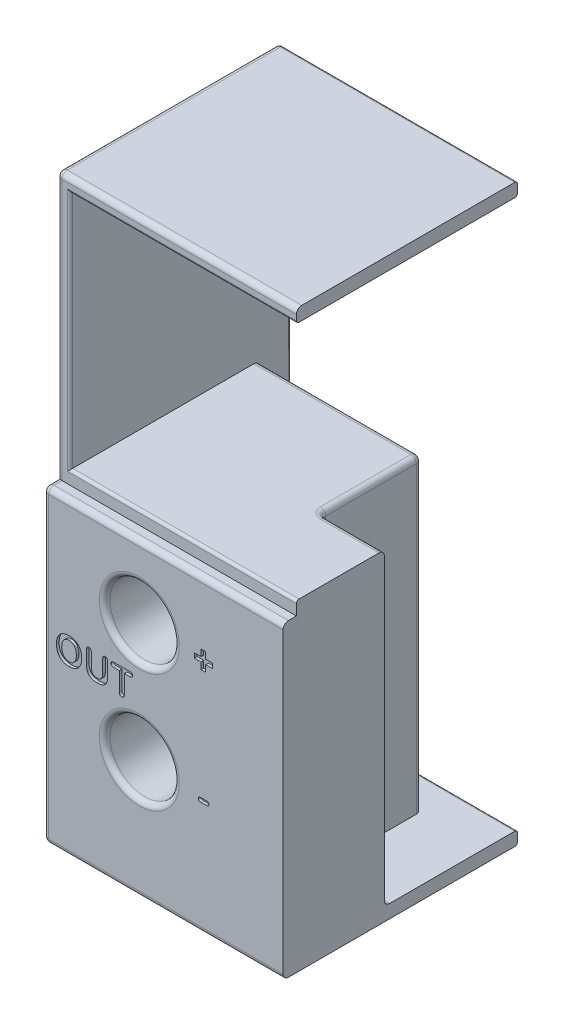
from build123d import *

# Parameters (mm, degrees)
SKETCH2_W               = 87.999717
SKETCH2_H               = 108
SKETCH2_R               = 6.5
SKETCH2_W_2             = 63.5
SKETCH2_H_2             = 21.25
BOSS_EXTRUDE1_DEPTH     = 46
SKETCH4_W               = 63.5
SKETCH4_H               = 21.25
BOSS_EXTRUDE2_DEPTH     = 44
BOSS_EXTRUDE3_START     = -10
SKETCH5_R               = 6.5
BOSS_EXTRUDE3_DEPTH     = 10
BOSS_EXTRUDE4_DEPTH     = 46
CUT_EXTRUDE1_START      = -45
SKETCH3_W               = 2
SKETCH3_H               = 20
CUT_EXTRUDE1_DEPTH      = 28
CUT_EXTRUDE2_START      = 45
SKETCH3_3_W             = 2
SKETCH3_3_H             = 20
CUT_EXTRUDE2_DEPTH      = 28
SKETCH6_W               = 85
SKETCH6_H               = 45
SKETCH6_W_2             = 63.5
SKETCH6_H_2             = 21.25
CUT_EXTRUDE4_DEPTH      = 85.00595217
SKETCH8_R               = 4.25
CUT_EXTRUDE5_DEPTH      = 79.974679487
SKETCH9_W               = 85
SKETCH9_H               = 103
CUT_EXTRUDE6_DEPTH      = 8
SKETCH6_4_W             = 90
SKETCH6_4_H             = 50
SKETCH6_4_W_2           = 85
SKETCH6_4_H_2           = 45
CUT_EXTRUDE7_DEPTH      = 2.5
CUT_EXTRUDE8_DEPTH      = 85.00595217
CUT_EXTRUDE8_DEPTH_BACK = 85.00595217
SKETCH10_W              = 2
SKETCH10_H              = 108
FILLET2_R               = 1
FILLET3_R               = 0.5
SKETCH11_W              = 24
SKETCH11_H              = 58
CUT_EXTRUDE9_DEPTH      = 19
FILLET4_R               = 1
CUT_EXTRUDE10_DEPTH     = 0.5
SKETCH13_W              = 45
SKETCH13_H              = 108
CUT_EXTRUDE12_DEPTH     = 83.927679336


with BuildPart() as part:
    # Sketch2 → Boss-Extrude1 (new body)
    with BuildSketch(Plane.XY):
        Rectangle(SKETCH2_W, SKETCH2_H)
        with Locations((-27, -9.375)):
            Circle(SKETCH2_R, mode=Mode.SUBTRACT)
        with Locations((27, -9.375)):
            Circle(SKETCH2_R, mode=Mode.SUBTRACT)
        with Locations((27, -31.625)):
            Circle(SKETCH2_R, mode=Mode.SUBTRACT)
        with Locations((-27, -31.625)):
            Circle(SKETCH2_R, mode=Mode.SUBTRACT)
        with Locations((0, 32.5)):
            Rectangle(SKETCH2_W_2, SKETCH2_H_2, mode=Mode.SUBTRACT)
    extrude(amount=-BOSS_EXTRUDE1_DEPTH)

    # Sketch4 → Boss-Extrude2 (add)
    with BuildSketch(Plane(origin=(0, 0, -46), x_dir=(-1, 0, 0), z_dir=(0, 0, -1))):
        with Locations((0, 32.5)):
            Rectangle(SKETCH4_W, SKETCH4_H)
    extrude(amount=-BOSS_EXTRUDE2_DEPTH)

    # Sketch5 → Boss-Extrude3 (add)
    with BuildSketch(Plane(origin=(0, 0, -46), x_dir=(-1, 0, 0), z_dir=(0, 0, -1)).offset(BOSS_EXTRUDE3_START)):
        with Locations(Location((-27, -9.375, 0), (0, 0, 180))):
            Circle(SKETCH5_R)
        with Locations(Location((-27, -31.625, 0), (0, 0, 180))):
            Circle(SKETCH5_R)
        with Locations(Location((27, -31.625, 0), (0, 0, 180))):
            Circle(SKETCH5_R)
        with Locations(Location((27, -9.375, 0), (0, 0, 180))):
            Circle(SKETCH5_R)
    extrude(amount=BOSS_EXTRUDE3_DEPTH)

    # Sketch7 → Boss-Extrude4 (add)
    with BuildSketch(Plane.XY):
        Polygon((45, 54), (43.9998585, 52.7998302), (43.9998585, -54), (45, -54), align=None)
        Polygon((-45, 54), (-45, -54), (-43.9998585, -52.7998302), (-43.9998585, 54), align=None)
        Polygon((43.9998585, 54), (43.9998585, 52.7998302), (45, 54), align=None)
        Polygon((-43.9998585, -52.7998302), (-45, -54), (-43.9998585, -54), align=None)
    extrude(amount=-BOSS_EXTRUDE4_DEPTH)

    # Sketch3 → Cut-Extrude1 (cut)
    with BuildSketch(Plane(origin=(0, 0, 0), x_dir=(0, 0, -1), z_dir=(1, 0, 0)).offset(CUT_EXTRUDE1_START)):
        with BuildLine():
            Line((34, -1.125), (34, 0.625))
            Line((34, 0.625), (19, 0.625))
            Line((19, 0.625), (19, -19.375))
            Line((19, -19.375), (34, -19.375))
            Line((34, -19.375), (34, -17.625))
            ThreePointArc((34, -17.625), (27.5, -9.375), (34, -1.125))
        make_face()
        with Locations((35, -9.375)):
            Rectangle(SKETCH3_W, SKETCH3_H)
        with BuildLine():
            Line((34, -21.625), (19, -21.625))
            Line((19, -21.625), (19, -41.625))
            Line((19, -41.625), (34, -41.625))
            Line((34, -41.625), (34, -39.875))
            ThreePointArc((34, -39.875), (27.5, -31.625), (34, -23.375))
            Line((34, -23.375), (34, -21.625))
        make_face()
        with BuildLine():
            Line((34, -39.875), (34, -23.375))
            ThreePointArc((34, -23.375), (27.5, -31.625), (34, -39.875))
        make_face()
        with Locations((35, -31.625)):
            Rectangle(SKETCH3_W, SKETCH3_H)
        with BuildLine():
            Line((34, -17.625), (34, -1.125))
            ThreePointArc((34, -1.125), (27.5, -9.375), (34, -17.625))
        make_face()
    extrude(amount=CUT_EXTRUDE1_DEPTH, mode=Mode.SUBTRACT)

    # Sketch3<3> → Cut-Extrude2 (cut)
    with BuildSketch(Plane(origin=(0, 0, 0), x_dir=(0, 0, -1), z_dir=(1, 0, 0)).offset(CUT_EXTRUDE2_START)):
        with BuildLine():
            Line((34, -1.125), (34, 0.625))
            Line((34, 0.625), (19, 0.625))
            Line((19, 0.625), (19, -19.375))
            Line((19, -19.375), (34, -19.375))
            Line((34, -19.375), (34, -17.625))
            ThreePointArc((34, -17.625), (27.5, -9.375), (34, -1.125))
        make_face()
        with BuildLine():
            Line((34, -17.625), (34, -1.125))
            ThreePointArc((34, -1.125), (27.5, -9.375), (34, -17.625))
        make_face()
        with Locations((35, -9.375)):
            Rectangle(SKETCH3_3_W, SKETCH3_3_H)
        with Locations((35, -31.625)):
            Rectangle(SKETCH3_3_W, SKETCH3_3_H)
        with BuildLine():
            Line((34, -39.875), (34, -23.375))
            ThreePointArc((34, -23.375), (27.5, -31.625), (34, -39.875))
        make_face()
        with BuildLine():
            Line((34, -21.625), (19, -21.625))
            Line((19, -21.625), (19, -41.625))
            Line((19, -41.625), (34, -41.625))
            Line((34, -41.625), (34, -39.875))
            ThreePointArc((34, -39.875), (27.5, -31.625), (34, -23.375))
            Line((34, -23.375), (34, -21.625))
        make_face()
    extrude(amount=-CUT_EXTRUDE2_DEPTH, mode=Mode.SUBTRACT)

    # Sketch6 → Cut-Extrude4 (cut, through all)
    # profile 1 of 2: a face of its own
    with BuildSketch(Plane.XY):
        with Locations((0, 29)):
            Rectangle(SKETCH6_W, SKETCH6_H)
        with Locations((0, 32.5)):
            Rectangle(SKETCH6_W_2, SKETCH6_H_2, mode=Mode.SUBTRACT)
    # profile 2 of 2: a face of its own
    with BuildSketch(Plane.XY):
        with Locations((0, 32.5)):
            Rectangle(SKETCH6_W_2, SKETCH6_H_2)
    extrude(amount=-CUT_EXTRUDE4_DEPTH, mode=Mode.SUBTRACT)

    # Sketch8 → Cut-Extrude5 (cut, through all)
    with BuildSketch(Plane.XY.offset(-36)):
        with Locations((-27, -9.375)):
            Circle(SKETCH8_R)
        with Locations((-27, -31.625)):
            Circle(SKETCH8_R)
        with Locations((27, -31.625)):
            Circle(SKETCH8_R)
        with Locations((27, -9.375)):
            Circle(SKETCH8_R)
    extrude(amount=-CUT_EXTRUDE5_DEPTH, mode=Mode.SUBTRACT)

    # Sketch9 → Cut-Extrude6 (cut)
    with BuildSketch(Plane(origin=(0, 0, -46), x_dir=(-1, 0, 0), z_dir=(0, 0, -1))):
        Rectangle(SKETCH9_W, SKETCH9_H)
    extrude(amount=-CUT_EXTRUDE6_DEPTH, mode=Mode.SUBTRACT)

    # Sketch6<4> → Cut-Extrude7 (cut)
    with BuildSketch(Plane.XY):
        with Locations((0, 29)):
            Rectangle(SKETCH6_4_W, SKETCH6_4_H)
        with Locations((0, 29)):
            Rectangle(SKETCH6_4_W_2, SKETCH6_4_H_2, mode=Mode.SUBTRACT)
    extrude(amount=-CUT_EXTRUDE7_DEPTH, mode=Mode.SUBTRACT)

    # Sketch10 → Cut-Extrude8 (cut, two sides: drawn at the far end of the back side and taken through both)
    with BuildSketch(Plane(origin=(0, 0, 0), x_dir=(0, 0, -1), z_dir=(1, 0, 0)).offset(-CUT_EXTRUDE8_DEPTH_BACK)):
        with Locations((45, 0)):
            Rectangle(SKETCH10_W, SKETCH10_H)
    extrude(amount=CUT_EXTRUDE8_DEPTH + CUT_EXTRUDE8_DEPTH_BACK, mode=Mode.SUBTRACT)

    # Fillet2
    fillet2_edges = [part.edges().sort_by_distance(p)[0] for p in [
        (-17, -31.625, -19),
        (-31, -21.625, -19),
        (-33.5, -31.625, -19),
        (-17, -31.625, -36),
        (-31, -41.625, -36),
        (-17, -41.625, -27.5),
        (-31, -41.625, -19),
        (-45, -21.625, -27.5),
        (-31, -21.625, -36),
        (-17, -21.625, -27.5),
        (-45, -31.625, -19),
        (-45, -31.625, -36),
        (-45, -41.625, -27.5),
        (-45, -9.375, -19),
        (-31, 0.625, -19),
        (-45, -9.375, -36),
        (-31, -19.375, -36),
        (-33.5, -9.375, -19),
        (-17, -19.375, -27.5),
        (-31, -19.375, -19),
        (-45, 0.625, -27.5),
        (-31, 0.625, -36),
        (-17, -9.375, -19),
        (-17, -9.375, -36),
        (-17, 0.625, -27.5),
        (-45, -19.375, -27.5),
        (45, -9.375, -36),
        (31, 0.625, -36),
        (45, -9.375, -19),
        (31, -19.375, -19),
        (17, -19.375, -27.5),
        (31, -19.375, -36),
        (20.5, -9.375, -19),
        (45, 0.625, -27.5),
        (31, 0.625, -19),
        (17, -9.375, -36),
        (17, -9.375, -19),
        (17, 0.625, -27.5),
        (45, -19.375, -27.5),
        (17, -31.625, -19),
        (31, -41.625, -19),
        (20.5, -31.625, -19),
        (17, -31.625, -36),
        (31, -21.625, -36),
        (45, -41.625, -27.5),
        (31, -41.625, -36),
        (17, -21.625, -27.5),
        (31, -21.625, -19),
        (17, -41.625, -27.5),
        (45, -31.625, -36),
        (45, -21.625, -27.5),
        (45, -31.625, -19),
        (0, -54, 0),
        (22.75, -9.375, -36),
        (20.5, -31.625, 0),
        (22.75, -31.625, -36),
        (-31.25, -31.625, -36),
        (-31.25, -9.375, -36),
        (20.5, -9.375, 0),
        (-33.5, -31.625, 0),
        (-33.5, -9.375, 0),
        (0, 6.5, -38),
        (-45, -25, 0),
        (45, -25, 0),
        (-45, 29, -2.5),
        (-45, 4, -1.25),
        (0, 54, -2.5),
        (45, 29, -2.5),
        (45, 4, -1.25),
        (0, 4, 0),
        (-45, -54, -22),
        (45, -54, -22),
        (-45, 54, -23.25),
        (45, 54, -23.25),
    ]]
    fillet(fillet2_edges, radius=FILLET2_R)

    # Fillet3
    fillet3_edges = [part.edges().sort_by_distance(p)[0] for p in [
        (22.75, -31.625, -38),
        (22.75, -9.375, -38),
        (-31.25, -9.375, -38),
        (-31.25, -31.625, -38),
        (0, 51.5, -2.5),
        (-42.5, 29, -2.5),
        (0, 6.5, -2.5),
        (42.5, 29, -2.5),
        (0, -51.5, -44),
        (42.5, 0, -44),
        (0, 51.5, -44),
        (-42.5, 0, -44),
        (-45, 0, -44),
        (45, 0, -44),
        (0, -54, -44),
        (0, 54, -44),
        (44.707106781, 53.707106781, -44),
        (-44.707106781, 53.707106781, -44),
        (-44.707106781, -53.707106781, -44),
        (44.707106781, -53.707106781, -44),
    ]]
    fillet(fillet3_edges, radius=FILLET3_R)

    # Sketch11 → Cut-Extrude9 (cut)
    with BuildSketch(Plane(origin=(0, 0, -38), x_dir=(-1, 0, 0), z_dir=(0, 0, -1))):
        with Locations((0, -22.5)):
            Rectangle(SKETCH11_W, SKETCH11_H)
    extrude(amount=-CUT_EXTRUDE9_DEPTH, mode=Mode.SUBTRACT)

    # Fillet4
    fillet4_edges = [part.edges().sort_by_distance(p)[0] for p in [
        (12, 6.207106781, -37.707106781),
        (-12, 6.207106781, -37.707106781),
        (-12, -23, -38),
        (12, -23, -38),
        (-12, 6.5, -28),
        (12, 6.5, -28),
        (-12, -22.5, -19),
        (0, -51.5, -19),
        (12, -22.5, -19),
        (0, 6.5, -19),
    ]]
    fillet(fillet4_edges, radius=FILLET4_R)

    # Sketch12 → Cut-Extrude10 (cut)
    # profile 1 of 9: a face of its own
    with BuildSketch(Plane.XY):
        with BuildLine():
            add(Edge.make_bspline(
                [(-40.204101563, -18.0625), (-40.142219014, -18.063368709), (-40.020879099, -18.065072082), (-39.842278019, -18.0805127), (-39.670025809, -18.103431299), (-39.504239086, -18.136420072), (-39.345329126, -18.179465633), (-39.193265668, -18.232369375), (-39.047852761, -18.294956068), (-38.908920342, -18.365997783), (-38.77799459, -18.446416769), (-38.654241911, -18.534359089), (-38.539064026, -18.631114909), (-38.43219245, -18.735834907), (-38.334309043, -18.848804815), (-38.243990785, -18.969397378), (-38.161933411, -19.098290949), (-38.089020705, -19.23545814), (-38.023513565, -19.378849399), (-37.966648985, -19.528884986), (-37.919187553, -19.684929266), (-37.879709879, -19.847240726), (-37.849789796, -20.015581804), (-37.828714559, -20.190346757), (-37.81412411, -20.370846257), (-37.813046628, -20.493459783), (-37.8125, -20.555664063)],
                knots=[0, 0, 0, 0, 1.137132438, 2.22970057, 3.292424762, 4.329649132, 5.333981859, 6.315987487, 7.286185149, 8.241436353, 9.181332131, 10.107725602, 11.0292572, 11.943085262, 12.854854597, 13.773819033, 14.709898734, 15.660115542, 16.626635295, 17.605574315, 18.606712189, 19.622473761, 20.67399022, 21.747038223, 22.857027702, 24, 24, 24, 24], degree=3))
            add(Edge.make_bspline(
                [(-37.8125, -20.555664063), (-37.814407642, -20.646879139), (-37.818150658, -20.825853777), (-37.846542647, -21.087869401), (-37.894672643, -21.337285549), (-37.96022212, -21.574001048), (-38.046378281, -21.796377097), (-38.151196568, -22.00412166), (-38.275708195, -22.196231979), (-38.418571732, -22.372534386), (-38.57924091, -22.5320302), (-38.758813404, -22.671073825), (-38.956175636, -22.789747841), (-39.169574475, -22.889709328), (-39.400288076, -22.968467406), (-39.647849295, -23.021416856), (-39.910729065, -23.057454879), (-40.09166815, -23.060788415), (-40.184570313, -23.0625)],
                knots=[0, 0, 0, 0, 1.119700056, 2.196982321, 3.230778928, 4.235358115, 5.208318876, 6.153781848, 7.087131445, 8.013361148, 8.934611457, 9.860297843, 10.794468433, 11.756326826, 12.748403726, 13.780058436, 14.860183413, 16, 16, 16, 16], degree=3))
            add(Edge.make_bspline(
                [(-40.184570313, -23.0625), (-40.276803124, -23.06027942), (-40.457365589, -23.055932231), (-40.720582827, -23.021097135), (-40.969461773, -22.965059913), (-41.20258146, -22.884937151), (-41.418313513, -22.78290435), (-41.617562497, -22.664138614), (-41.796462748, -22.523837845), (-41.957312206, -22.366006832), (-42.100098053, -22.190396648), (-42.221488428, -21.996136894), (-42.328544833, -21.787455566), (-42.413165738, -21.561257329), (-42.480490707, -21.32244949), (-42.5279401, -21.072812122), (-42.556870777, -20.813835192), (-42.56060378, -20.638096536), (-42.5625, -20.548828125)],
                knots=[0, 0, 0, 0, 1.130091603, 2.212359386, 3.247930852, 4.252250901, 5.226719473, 6.16821431, 7.089197795, 8.00610207, 8.925165125, 9.855999165, 10.808795857, 11.79501972, 12.810514548, 13.846493258, 14.906102224, 16, 16, 16, 16], degree=3))
            add(Edge.make_bspline(
                [(-42.5625, -20.548828125), (-42.560779931, -20.457917793), (-42.557397661, -20.279155552), (-42.52617064, -20.017250939), (-42.476867474, -19.76650569), (-42.406593898, -19.528182138), (-42.317493046, -19.303954514), (-42.20934334, -19.096268157), (-42.084128705, -18.905766816), (-41.941020547, -18.732813051), (-41.779791607, -18.578459843), (-41.601343885, -18.443470626), (-41.406555768, -18.327351299), (-41.195418304, -18.231841316), (-40.968892091, -18.155181952), (-40.727036042, -18.101058131), (-40.470304863, -18.068269124), (-40.294370818, -18.064456304), (-40.204101563, -18.0625)],
                knots=[0, 0, 0, 0, 1.125218611, 2.212582392, 3.260701818, 4.286054269, 5.284468473, 6.243521648, 7.180287843, 8.101949555, 9.017004541, 9.937572836, 10.866572707, 11.818894766, 12.801573564, 13.82236102, 14.882684417, 16, 16, 16, 16], degree=3))
        make_face()
        with BuildLine():
            add(Edge.make_bspline(
                [(-38.8125, -20.548828125), (-38.814409711, -20.461806319), (-38.818107355, -20.293311934), (-38.850878723, -20.049572404), (-38.903958219, -19.823491976), (-38.967222357, -19.648437478), (-39.027971578, -19.51867883), (-39.077585349, -19.428366426), (-39.130955162, -19.343341598), (-39.191528722, -19.266437061), (-39.254362066, -19.193984208), (-39.322390378, -19.127691549), (-39.395732164, -19.068546163), (-39.498508546, -18.996758293), (-39.636913927, -18.922373447), (-39.815617192, -18.858633433), (-40.006108222, -18.819354309), (-40.137179526, -18.814816767), (-40.204101563, -18.8125)],
                knots=[0, 0, 0, 0, 1.663767962, 3.22144036, 4.693807908, 6.09809827, 6.772124886, 7.43249818, 8.068074837, 8.689496673, 9.30272399, 9.901527182, 10.503429657, 11.102750509, 12.297797107, 13.495176895, 14.721094103, 16, 16, 16, 16], degree=3))
            add(Edge.make_bspline(
                [(-40.204101563, -18.8125), (-40.252038776, -18.813692449), (-40.346782105, -18.816049209), (-40.485861893, -18.838431131), (-40.619461179, -18.87343406), (-40.746958383, -18.922391316), (-40.86721804, -18.984912243), (-40.979702156, -19.060816842), (-41.083054339, -19.149809619), (-41.177853092, -19.25153021), (-41.263531901, -19.367003595), (-41.339544956, -19.497427585), (-41.40577496, -19.642803935), (-41.462238579, -19.801835484), (-41.506895778, -19.973704465), (-41.538649307, -20.156608918), (-41.558596828, -20.349495293), (-41.561179593, -20.481395653), (-41.5625, -20.548828125)],
                knots=[0, 0, 0, 0, 0.926902171, 1.831933723, 2.71800685, 3.595261319, 4.468550136, 5.334998465, 6.214894287, 7.1017058, 8.020008637, 8.99111482, 10.01694856, 11.106630737, 12.25237115, 13.448355624, 14.695502513, 16, 16, 16, 16], degree=3))
            add(Edge.make_bspline(
                [(-41.5625, -20.548828125), (-41.561175948, -20.616910417), (-41.558585554, -20.750107531), (-41.538678745, -20.94495126), (-41.506717933, -21.130076126), (-41.462379635, -21.304715937), (-41.405018449, -21.466834698), (-41.336159513, -21.614946915), (-41.258965571, -21.750109054), (-41.167899319, -21.868552345), (-41.069532555, -21.973072777), (-40.963817326, -22.06410939), (-40.851516456, -22.141662991), (-40.731554552, -22.204799085), (-40.604589267, -22.252170855), (-40.472024127, -22.288072541), (-40.332998529, -22.308578568), (-40.238345748, -22.311182043), (-40.190429688, -22.3125)],
                knots=[0, 0, 0, 0, 1.300369924, 2.54406124, 3.737115199, 4.88637188, 5.981883645, 7.016846829, 8.003376514, 8.948590554, 9.863559023, 10.741055788, 11.608647785, 12.46534091, 13.323432129, 14.192248925, 15.0848625, 16, 16, 16, 16], degree=3))
            add(Edge.make_bspline(
                [(-40.190429688, -22.3125), (-40.128714879, -22.310432989), (-40.007115757, -22.306360277), (-39.829062488, -22.268333598), (-39.65894479, -22.208545464), (-39.524248456, -22.139704674), (-39.422731166, -22.071892244), (-39.349371171, -22.014681888), (-39.281172171, -21.949579237), (-39.216166088, -21.879097392), (-39.155929432, -21.801699497), (-39.098897641, -21.718367101), (-39.046241602, -21.628209325), (-38.997525615, -21.53173024), (-38.95353172, -21.42910536), (-38.915158866, -21.320607226), (-38.884568811, -21.205758865), (-38.857870644, -21.085626874), (-38.837560064, -20.959421065), (-38.823117244, -20.827745953), (-38.814067885, -20.690231108), (-38.81303074, -20.596694032), (-38.8125, -20.548828125)],
                knots=[0, 0, 0, 0, 1.468568495, 2.893578421, 4.316075305, 5.755382189, 6.482330971, 7.222315454, 7.968369796, 8.725783183, 9.504530818, 10.302500265, 11.129737207, 11.9897977, 12.875655565, 13.787998707, 14.728608307, 15.705132475, 16.718642732, 17.771954593, 18.859838044, 20, 20, 20, 20], degree=3))
        make_face(mode=Mode.SUBTRACT)
    # profile 2 of 9: a face of its own
    with BuildSketch(Plane.XY):
        with BuildLine():
            Line((-36.9375, -20.981445313), (-36.9375, -18.65625))
            add(Edge.make_bspline(
                [(-36.9375, -18.65625), (-36.936347915, -18.609560537), (-36.934186191, -18.521954458), (-36.909347602, -18.399701183), (-36.870478375, -18.295100271), (-36.81330714, -18.209823291), (-36.743514772, -18.143210616), (-36.661901868, -18.096558932), (-36.571075194, -18.066512432), (-36.506755039, -18.06386389), (-36.473632813, -18.0625)],
                knots=[0, 0, 0, 0, 1.314006093, 2.465543923, 3.499702682, 4.438645347, 5.334276599, 6.193453487, 7.069703068, 8, 8, 8, 8], degree=3))
            add(Edge.make_bspline(
                [(-36.473632813, -18.0625), (-36.438939423, -18.064363054), (-36.372286212, -18.067942368), (-36.277450995, -18.095840638), (-36.194605213, -18.143871779), (-36.123835804, -18.210848219), (-36.067342536, -18.296948281), (-36.027775176, -18.402193177), (-36.003534117, -18.525270354), (-36.001222859, -18.613483661), (-36, -18.66015625)],
                knots=[0, 0, 0, 0, 0.96282878, 1.849794185, 2.716851436, 3.599658085, 4.532680285, 5.552030856, 6.704809248, 8, 8, 8, 8], degree=3))
            Line((-36, -18.66015625), (-36, -21.053710938))
            add(Edge.make_bspline(
                [(-36, -21.053710938), (-35.99889066, -21.119176272), (-35.996767426, -21.244474345), (-35.980352355, -21.424389171), (-35.952620356, -21.587521133), (-35.913468807, -21.734879035), (-35.858654871, -21.866513437), (-35.785781742, -21.982442862), (-35.694423845, -22.082436057), (-35.604389303, -22.152348162), (-35.523320188, -22.198607116), (-35.455881093, -22.22899436), (-35.38297238, -22.255675736), (-35.303537405, -22.275251537), (-35.21924944, -22.292442399), (-35.128794967, -22.303466192), (-35.032714084, -22.312002141), (-34.966492651, -22.312331511), (-34.932617188, -22.3125)],
                knots=[0, 0, 0, 0, 1.640841622, 3.140506311, 4.523579023, 5.784571649, 6.954579444, 8.084197464, 9.198982671, 10.333306227, 10.925380769, 11.535182691, 12.185613052, 12.868404783, 13.583722754, 14.340779317, 15.151228418, 16, 16, 16, 16], degree=3))
            add(Edge.make_bspline(
                [(-34.932617188, -22.3125), (-34.886018292, -22.311674313), (-34.796154634, -22.310082015), (-34.666915353, -22.294831437), (-34.547810982, -22.27254376), (-34.439976213, -22.237904472), (-34.342004443, -22.195029342), (-34.254772573, -22.142425249), (-34.177901824, -22.079862251), (-34.111987738, -22.006889167), (-34.056360614, -21.923270422), (-34.007144985, -21.831202928), (-33.966579922, -21.728768874), (-33.932253732, -21.61717405), (-33.906095076, -21.495290392), (-33.887966427, -21.363741724), (-33.877290695, -21.222181646), (-33.875781426, -21.124693418), (-33.875, -21.07421875)],
                knots=[0, 0, 0, 0, 1.187087794, 2.289239917, 3.312641325, 4.270309596, 5.169103343, 6.032749862, 6.858132282, 7.686303516, 8.528484611, 9.411791075, 10.342302716, 11.33164497, 12.384483705, 13.515514569, 14.713654137, 16, 16, 16, 16], degree=3))
            Line((-33.875, -21.07421875), (-33.875, -18.66015625))
            add(Edge.make_bspline(
                [(-33.875, -18.66015625), (-33.873685282, -18.612853927), (-33.871218239, -18.524091977), (-33.848475161, -18.400133957), (-33.808724112, -18.295398446), (-33.752835216, -18.209945927), (-33.683718699, -18.142612396), (-33.601499713, -18.096857609), (-33.509937038, -18.066252371), (-33.444926434, -18.063783409), (-33.411132813, -18.0625)],
                knots=[0, 0, 0, 0, 1.324209478, 2.484855026, 3.512713035, 4.440887327, 5.324452051, 6.186293477, 7.057204391, 8, 8, 8, 8], degree=3))
            add(Edge.make_bspline(
                [(-33.411132813, -18.0625), (-33.377364158, -18.063865071), (-33.311778592, -18.066516314), (-33.21904633, -18.096543029), (-33.135875484, -18.142868959), (-33.064442019, -18.209061932), (-33.00544498, -18.293736648), (-32.965148551, -18.399135464), (-32.941017171, -18.522664676), (-32.938719595, -18.611204538), (-32.9375, -18.658203125)],
                knots=[0, 0, 0, 0, 0.937671153, 1.821147261, 2.686184232, 3.571984669, 4.510357278, 5.535961965, 6.692043289, 8, 8, 8, 8], degree=3))
            Line((-32.9375, -18.658203125), (-32.9375, -20.9921875))
            add(Edge.make_bspline(
                [(-32.9375, -20.9921875), (-32.938814946, -21.083039659), (-32.941339732, -21.257482084), (-32.960267279, -21.507426996), (-32.993362685, -21.733860143), (-33.038094829, -21.939597905), (-33.102992598, -22.128276032), (-33.192235417, -22.30285969), (-33.3043956, -22.466365378), (-33.396080085, -22.562684701), (-33.442382813, -22.611328125)],
                knots=[0, 0, 0, 0, 1.248457049, 2.397123805, 3.441600438, 4.391152342, 5.286682789, 6.174943873, 7.078305605, 8, 8, 8, 8], degree=3))
            add(Edge.make_bspline(
                [(-33.442382813, -22.611328125), (-33.486816817, -22.648867023), (-33.575580817, -22.72385695), (-33.723495667, -22.817039267), (-33.880907486, -22.896203445), (-34.049981491, -22.958697173), (-34.231695061, -23.005474425), (-34.42711508, -23.037961431), (-34.636914453, -23.058930849), (-34.781848334, -23.061287196), (-34.856445313, -23.0625)],
                knots=[0, 0, 0, 0, 0.917673777, 1.83319953, 2.752815171, 3.696261941, 4.673826777, 5.7116717, 6.822205161, 8, 8, 8, 8], degree=3))
            add(Edge.make_bspline(
                [(-34.856445313, -23.0625), (-34.945041021, -23.061054572), (-35.11602359, -23.058265014), (-35.362992947, -23.035453679), (-35.59115974, -22.999491216), (-35.80038398, -22.946707796), (-35.991758558, -22.879304535), (-36.163349314, -22.792178873), (-36.319002206, -22.691987195), (-36.454850533, -22.572271952), (-36.573259477, -22.435920236), (-36.674960776, -22.282188342), (-36.757035815, -22.109682213), (-36.825457088, -21.920505185), (-36.87453983, -21.712198793), (-36.912072948, -21.485854188), (-36.932824061, -21.239967141), (-36.93590376, -21.069697737), (-36.9375, -20.981445313)],
                knots=[0, 0, 0, 0, 1.244583114, 2.401944964, 3.48169555, 4.486712429, 5.430003149, 6.325898902, 7.184706889, 8.024138875, 8.860562605, 9.715550095, 10.605366032, 11.538500779, 12.536866304, 13.60758979, 14.759988597, 16, 16, 16, 16], degree=3))
        make_face()
    # profile 3 of 9: a face of its own
    with BuildSketch(Plane.XY):
        with BuildLine():
            Line((-28.745117188, -19), (-29.8125, -19))
            Line((-29.8125, -19), (-29.8125, -22.47265625))
            add(Edge.make_bspline(
                [(-29.8125, -22.47265625), (-29.813657073, -22.519665199), (-29.815821135, -22.607585544), (-29.840444898, -22.730371911), (-29.880326392, -22.834692417), (-29.938406433, -22.918913784), (-30.008809833, -22.983769579), (-30.090108837, -23.029549039), (-30.181052362, -23.058224996), (-30.24522422, -23.0610454), (-30.278320313, -23.0625)],
                knots=[0, 0, 0, 0, 1.324771526, 2.4777063, 3.516495944, 4.454151167, 5.338361256, 6.19400724, 7.068574513, 8, 8, 8, 8], degree=3))
            add(Edge.make_bspline(
                [(-30.278320313, -23.0625), (-30.311785823, -23.061172111), (-30.376777519, -23.058593283), (-30.468397513, -23.028011397), (-30.551928478, -22.98331378), (-30.622940466, -22.916801763), (-30.682108754, -22.832713736), (-30.72067972, -22.727778171), (-30.746982853, -22.606447162), (-30.748953809, -22.519048027), (-30.75, -22.47265625)],
                knots=[0, 0, 0, 0, 0.936591527, 1.818907611, 2.686883908, 3.580272073, 4.52668274, 5.549195867, 6.699104295, 8, 8, 8, 8], degree=3))
            Line((-30.75, -22.47265625), (-30.75, -19))
            Line((-30.75, -19), (-31.818359375, -19))
            add(Edge.make_bspline(
                [(-31.818359375, -19), (-31.857558989, -18.999027325), (-31.931105492, -18.997202388), (-32.033183239, -18.975092322), (-32.120787236, -18.941882109), (-32.191671431, -18.891924127), (-32.245912788, -18.830486748), (-32.285529969, -18.760081709), (-32.308075229, -18.680390244), (-32.310996015, -18.624488378), (-32.3125, -18.595703125)],
                knots=[0, 0, 0, 0, 1.298175259, 2.435642608, 3.448405227, 4.386245553, 5.281324188, 6.14672195, 7.045701294, 8, 8, 8, 8], degree=3))
            add(Edge.make_bspline(
                [(-32.3125, -18.595703125), (-32.311247918, -18.565554112), (-32.308833523, -18.507417629), (-32.283329306, -18.425945796), (-32.243636614, -18.353897492), (-32.186560863, -18.293822576), (-32.114862047, -18.245009031), (-32.028070201, -18.211391908), (-31.927722451, -18.190746532), (-31.856231461, -18.188624264), (-31.818359375, -18.1875)],
                knots=[0, 0, 0, 0, 0.993926626, 1.916593339, 2.793690024, 3.692250099, 4.629614642, 5.63892321, 6.749228366, 8, 8, 8, 8], degree=3))
            Line((-31.818359375, -18.1875), (-28.745117188, -18.1875))
            add(Edge.make_bspline(
                [(-28.745117188, -18.1875), (-28.705275506, -18.188508285), (-28.630456794, -18.190401743), (-28.52655638, -18.212087944), (-28.437800612, -18.246313023), (-28.367301212, -18.297922779), (-28.311178966, -18.358681581), (-28.272670556, -18.430396477), (-28.248088606, -18.510125573), (-28.245485907, -18.566542407), (-28.244140625, -18.595703125)],
                knots=[0, 0, 0, 0, 1.304496451, 2.449714448, 3.464685333, 4.39788137, 5.28974218, 6.154486031, 7.046091257, 8, 8, 8, 8], degree=3))
            add(Edge.make_bspline(
                [(-28.244140625, -18.595703125), (-28.245556319, -18.624509871), (-28.248310157, -18.680545355), (-28.272174801, -18.760180811), (-28.312729287, -18.830547282), (-28.367969961, -18.89196525), (-28.439818128, -18.94187864), (-28.528657631, -18.975240046), (-28.631760922, -18.997026322), (-28.705927235, -18.998971929), (-28.745117188, -19)],
                knots=[0, 0, 0, 0, 0.94771637, 1.843517728, 2.708217129, 3.604275273, 4.544436114, 5.560171289, 6.710778986, 8, 8, 8, 8], degree=3))
        make_face()
    # profile 4 of 9: a face of its own
    with BuildSketch(Plane.XY):
        with BuildLine():
            Line((32.4375, -22.465820313), (32.4375, -18.65625))
            add(Edge.make_bspline(
                [(32.4375, -18.65625), (32.438643547, -18.609554715), (32.440789249, -18.521937711), (32.465733108, -18.39975622), (32.504325843, -18.294751077), (32.562775756, -18.210113201), (32.632401848, -18.143169865), (32.714091115, -18.096570131), (32.804584088, -18.066611246), (32.868573218, -18.063893054), (32.901367187, -18.0625)],
                knots=[0, 0, 0, 0, 1.314663, 2.466776515, 3.501452278, 4.446007437, 5.34208644, 6.201692853, 7.078380494, 8, 8, 8, 8], degree=3))
            add(Edge.make_bspline(
                [(32.901367187, -18.0625), (32.935135716, -18.063865122), (33.000721037, -18.066516466), (33.093455042, -18.096542467), (33.17661943, -18.142871041), (33.248077981, -18.209053741), (33.306798442, -18.293520353), (33.34741112, -18.398101806), (33.371534885, -18.521032872), (33.373795616, -18.609252046), (33.375, -18.65625)],
                knots=[0, 0, 0, 0, 0.939704012, 1.825095485, 2.692007845, 3.579728686, 4.520135675, 5.539530793, 6.689207656, 8, 8, 8, 8], degree=3))
            Line((33.375, -18.65625), (33.375, -22.465820313))
            add(Edge.make_bspline(
                [(33.375, -22.465820313), (33.373805235, -22.512819272), (33.37156256, -22.601040335), (33.347261779, -22.724256909), (33.306749817, -22.82939308), (33.248449526, -22.91498494), (33.176278301, -22.980853961), (33.093956455, -23.029009161), (33.000432773, -23.056885259), (32.935079764, -23.060589272), (32.901367187, -23.0625)],
                knots=[0, 0, 0, 0, 1.307751878, 2.454761992, 3.480206064, 4.425894871, 5.311556588, 6.180961951, 7.061642901, 8, 8, 8, 8], degree=3))
            add(Edge.make_bspline(
                [(32.901367187, -23.0625), (32.868958253, -23.060558866), (32.805849946, -23.056778993), (32.715428305, -23.029033521), (32.635454587, -22.979972006), (32.56442116, -22.9140444), (32.505147213, -22.828460081), (32.467193553, -22.722447896), (32.440376435, -22.600287941), (32.438499535, -22.512546578), (32.4375, -22.465820313)],
                knots=[0, 0, 0, 0, 0.912572231, 1.777006537, 2.632638816, 3.534642503, 4.491136576, 5.533474522, 6.686463005, 8, 8, 8, 8], degree=3))
        make_face()
    # profile 5 of 9: a face of its own
    with BuildSketch(Plane.XY):
        with BuildLine():
            Line((35.787109375, -18.649414063), (37.6875, -21.5))
            Line((37.6875, -21.5), (37.6875, -18.623046875))
            add(Edge.make_bspline(
                [(37.6875, -18.623046875), (37.688967089, -18.579010182), (37.691715012, -18.496527494), (37.712591005, -18.380878978), (37.74917017, -18.282776521), (37.801005478, -18.20221468), (37.865452464, -18.139204827), (37.941547557, -18.094442008), (38.027794079, -18.067009974), (38.088659627, -18.064036698), (38.120117188, -18.0625)],
                knots=[0, 0, 0, 0, 1.319117216, 2.470765316, 3.505116792, 4.43580569, 5.318756254, 6.18027265, 7.059497782, 8, 8, 8, 8], degree=3))
            add(Edge.make_bspline(
                [(38.120117188, -18.0625), (38.152531882, -18.064065554), (38.215273445, -18.067095825), (38.304001596, -18.093969467), (38.381550309, -18.139196897), (38.447017136, -18.202122215), (38.499797352, -18.28268682), (38.537660955, -18.380669347), (38.558201659, -18.496555875), (38.561003907, -18.57902006), (38.5625, -18.623046875)],
                knots=[0, 0, 0, 0, 0.959871134, 1.857917088, 2.719075999, 3.600089629, 4.526699118, 5.554128738, 6.694173474, 8, 8, 8, 8], degree=3))
            Line((38.5625, -18.623046875), (38.5625, -22.42578125))
            add(Edge.make_bspline(
                [(38.5625, -22.42578125), (38.561293623, -22.475696837), (38.559029392, -22.569382615), (38.534906572, -22.700379865), (38.494225141, -22.811882756), (38.437305638, -22.904397618), (38.362391295, -22.976980916), (38.269778573, -23.026870963), (38.161798711, -23.058030745), (38.084539552, -23.060960579), (38.043945312, -23.0625)],
                knots=[0, 0, 0, 0, 1.276164049, 2.395212213, 3.391561633, 4.297456637, 5.151673506, 6.027862746, 6.963780962, 8, 8, 8, 8], degree=3))
            add(Edge.make_bspline(
                [(38.043945312, -23.0625), (38.002789087, -23.060568961), (37.923409742, -23.056844502), (37.809055553, -23.02965263), (37.705082087, -22.978923283), (37.611659905, -22.90557179), (37.524201899, -22.816608833), (37.444148006, -22.713420226), (37.368725794, -22.601624608), (37.31710543, -22.526334263), (37.291015625, -22.48828125)],
                knots=[0, 0, 0, 0, 0.990229924, 1.909888509, 2.806876858, 3.75171819, 4.754420985, 5.802993103, 6.889595585, 8, 8, 8, 8], degree=3))
            Line((37.291015625, -22.48828125), (35.4375, -19.6875))
            Line((35.4375, -19.6875), (35.4375, -22.504882813))
            add(Edge.make_bspline(
                [(35.4375, -22.504882813), (35.436036307, -22.547938792), (35.433263701, -22.629497779), (35.411855241, -22.744183748), (35.372471416, -22.842106499), (35.318360969, -22.922634501), (35.251913254, -22.985290653), (35.175949163, -23.030398667), (35.090705587, -23.057908316), (35.030805512, -23.060940568), (35, -23.0625)],
                knots=[0, 0, 0, 0, 1.293064309, 2.449392962, 3.484384031, 4.441729672, 5.340986808, 6.204611779, 7.076664708, 8, 8, 8, 8], degree=3))
            add(Edge.make_bspline(
                [(35, -23.0625), (34.968539892, -23.060998934), (34.907259618, -23.058075048), (34.820516547, -23.029815038), (34.744224961, -22.983177012), (34.677600434, -22.920167138), (34.625760233, -22.838120196), (34.588733065, -22.740192856), (34.566493997, -22.626306887), (34.563883519, -22.545029234), (34.5625, -22.501953125)],
                knots=[0, 0, 0, 0, 0.938889884, 1.828837584, 2.693878765, 3.596100726, 4.546832571, 5.570326044, 6.712304089, 8, 8, 8, 8], degree=3))
            Line((34.5625, -22.501953125), (34.5625, -18.771484375))
            add(Edge.make_bspline(
                [(34.5625, -18.771484375), (34.562866376, -18.734013867), (34.563559158, -18.663160664), (34.573805999, -18.563394484), (34.587808296, -18.4755907), (34.60516579, -18.423017833), (34.61328125, -18.3984375)],
                knots=[0, 0, 0, 0, 1.18793306, 2.246269525, 3.180047019, 4, 4, 4, 4], degree=3))
            add(Edge.make_bspline(
                [(34.61328125, -18.3984375), (34.624171136, -18.374519786), (34.645912187, -18.326769403), (34.693585215, -18.263498293), (34.747997085, -18.204529475), (34.81366266, -18.15594809), (34.884514081, -18.114658781), (34.959655854, -18.084142498), (35.038189814, -18.06582318), (35.09137625, -18.063613118), (35.118164062, -18.0625)],
                knots=[0, 0, 0, 0, 0.980600708, 1.957714689, 2.948627098, 3.97434472, 5.000279326, 6.011426356, 6.998437519, 8, 8, 8, 8], degree=3))
            add(Edge.make_bspline(
                [(35.118164062, -18.0625), (35.158192841, -18.064092522), (35.233254113, -18.067078791), (35.336754319, -18.101647792), (35.424863608, -18.152322857), (35.501056635, -18.221492432), (35.57309913, -18.30697701), (35.639869357, -18.412366203), (35.71217371, -18.52814521), (35.761749808, -18.608374517), (35.787109375, -18.649414063)],
                knots=[0, 0, 0, 0, 1.01695463, 1.906975685, 2.751376853, 3.592506721, 4.517315556, 5.594915983, 6.76973195, 8, 8, 8, 8], degree=3))
        make_face()
    # profile 6 of 9: a face of its own
    with BuildSketch(Plane.XY):
        Polygon((-14.522682188, -11.1875), (-15.397682188, -11.1875), (-15.397682188, -9.9375), (-16.659400938, -9.9375), (-16.659400938, -9.0625), (-15.397682188, -9.0625), (-15.397682188, -7.8125), (-14.522682188, -7.8125), (-14.522682188, -9.0625), (-13.254127501, -9.0625), (-13.254127501, -9.9375), (-14.522682188, -9.9375), align=None)
    # profile 7 of 9: a face of its own
    with BuildSketch(Plane.XY):
        with BuildLine():
            Line((-14.411354063, -32.75), (-15.446510313, -32.75))
            add(Edge.make_bspline(
                [(-15.446510313, -32.75), (-15.483728445, -32.748810461), (-15.553858549, -32.746569012), (-15.652051779, -32.726862015), (-15.737118614, -32.695546818), (-15.806313483, -32.648619181), (-15.86133667, -32.592575907), (-15.900186363, -32.527200376), (-15.924812703, -32.454512589), (-15.927538485, -32.40319303), (-15.928932188, -32.376953125)],
                knots=[0, 0, 0, 0, 1.299805928, 2.449223535, 3.486898841, 4.446433637, 5.347856832, 6.21051608, 7.085029387, 8, 8, 8, 8], degree=3))
            add(Edge.make_bspline(
                [(-15.928932188, -32.376953125), (-15.927460116, -32.350098037), (-15.924603475, -32.297984181), (-15.901588947, -32.224026731), (-15.862967144, -32.158771421), (-15.810688995, -32.101085092), (-15.741489649, -32.054068505), (-15.655917148, -32.02320672), (-15.556143428, -32.003290066), (-15.484709054, -32.001146336), (-15.446510313, -32)],
                knots=[0, 0, 0, 0, 0.930252909, 1.805209739, 2.655335837, 3.542447437, 4.485088836, 5.525143206, 6.676597728, 8, 8, 8, 8], degree=3))
            Line((-15.446510313, -32), (-14.411354063, -32))
            add(Edge.make_bspline(
                [(-14.411354063, -32), (-14.37315931, -32.00116056), (-14.301732394, -32.003330891), (-14.202208993, -32.023014209), (-14.117064493, -32.05426825), (-14.048176823, -32.101390906), (-13.994841642, -32.158426744), (-13.95632081, -32.224067988), (-13.933248571, -32.297972971), (-13.930400067, -32.350094225), (-13.928932188, -32.376953125)],
                knots=[0, 0, 0, 0, 1.32387857, 2.475747504, 3.505638844, 4.448619502, 5.343708498, 6.194140559, 7.06941229, 8, 8, 8, 8], degree=3))
            add(Edge.make_bspline(
                [(-13.928932188, -32.376953125), (-13.930522006, -32.40313267), (-13.933619461, -32.454138491), (-13.955309123, -32.527336339), (-13.993686647, -32.592136376), (-14.046549584, -32.648917181), (-14.11513059, -32.695708593), (-14.200543891, -32.727144105), (-14.30077577, -32.746629169), (-14.372838742, -32.748825912), (-14.411354063, -32.75)],
                knots=[0, 0, 0, 0, 0.911547891, 1.775976195, 2.629630521, 3.512087315, 4.458640903, 5.492434473, 6.659787555, 8, 8, 8, 8], degree=3))
        make_face()
    # profile 8 of 9: a face of its own
    with BuildSketch(Plane.XY):
        Polygon((15.335182188, -11.1875), (14.460182188, -11.1875), (14.460182188, -9.9375), (13.198463438, -9.9375), (13.198463438, -9.0625), (14.460182188, -9.0625), (14.460182188, -7.8125), (15.335182188, -7.8125), (15.335182188, -9.0625), (16.603736876, -9.0625), (16.603736876, -9.9375), (15.335182188, -9.9375), align=None)
    # profile 9 of 9: a face of its own
    with BuildSketch(Plane.XY):
        with BuildLine():
            Line((15.446510313, -32.75), (14.411354063, -32.75))
            add(Edge.make_bspline(
                [(14.411354063, -32.75), (14.374135931, -32.748810461), (14.304005827, -32.746569012), (14.205812598, -32.726862015), (14.120745762, -32.695546818), (14.051550893, -32.648619181), (13.996527706, -32.592575907), (13.957678013, -32.527200376), (13.933051673, -32.454512589), (13.930325892, -32.40319303), (13.928932188, -32.376953125)],
                knots=[0, 0, 0, 0, 1.299805928, 2.449223535, 3.486898841, 4.446433637, 5.347856832, 6.21051608, 7.085029387, 8, 8, 8, 8], degree=3))
            add(Edge.make_bspline(
                [(13.928932188, -32.376953125), (13.93040426, -32.350098037), (13.933260901, -32.297984181), (13.956275429, -32.224026731), (13.994897232, -32.158771421), (14.047175382, -32.101085092), (14.116374727, -32.054068505), (14.201947229, -32.02320672), (14.301720948, -32.003290066), (14.373155322, -32.001146336), (14.411354063, -32)],
                knots=[0, 0, 0, 0, 0.930252909, 1.805209739, 2.655335837, 3.542447437, 4.485088836, 5.525143206, 6.676597728, 8, 8, 8, 8], degree=3))
            Line((14.411354063, -32), (15.446510313, -32))
            add(Edge.make_bspline(
                [(15.446510313, -32), (15.484705066, -32.00116056), (15.556131982, -32.003330891), (15.655655383, -32.023014209), (15.740799883, -32.05426825), (15.809687553, -32.101390906), (15.863022734, -32.158426744), (15.901543566, -32.224067988), (15.924615806, -32.297972971), (15.927464309, -32.350094225), (15.928932188, -32.376953125)],
                knots=[0, 0, 0, 0, 1.32387857, 2.475747504, 3.505638844, 4.448619502, 5.343708498, 6.194140559, 7.06941229, 8, 8, 8, 8], degree=3))
            add(Edge.make_bspline(
                [(15.928932188, -32.376953125), (15.92734237, -32.40313267), (15.924244915, -32.454138491), (15.902555253, -32.527336339), (15.864177729, -32.592136376), (15.811314792, -32.648917181), (15.742733786, -32.695708593), (15.657320485, -32.727144105), (15.557088606, -32.746629169), (15.485025634, -32.748825912), (15.446510313, -32.75)],
                knots=[0, 0, 0, 0, 0.911547891, 1.775976195, 2.629630521, 3.512087315, 4.458640903, 5.492434473, 6.659787555, 8, 8, 8, 8], degree=3))
        make_face()
    extrude(amount=-CUT_EXTRUDE10_DEPTH, mode=Mode.SUBTRACT)

    # Sketch13 → Cut-Extrude12 (cut, through all)
    with BuildSketch(Plane.XY):
        with Locations((22.5, 0)):
            Rectangle(SKETCH13_W, SKETCH13_H)
    extrude(amount=-CUT_EXTRUDE12_DEPTH, mode=Mode.SUBTRACT)


solid = part.part
